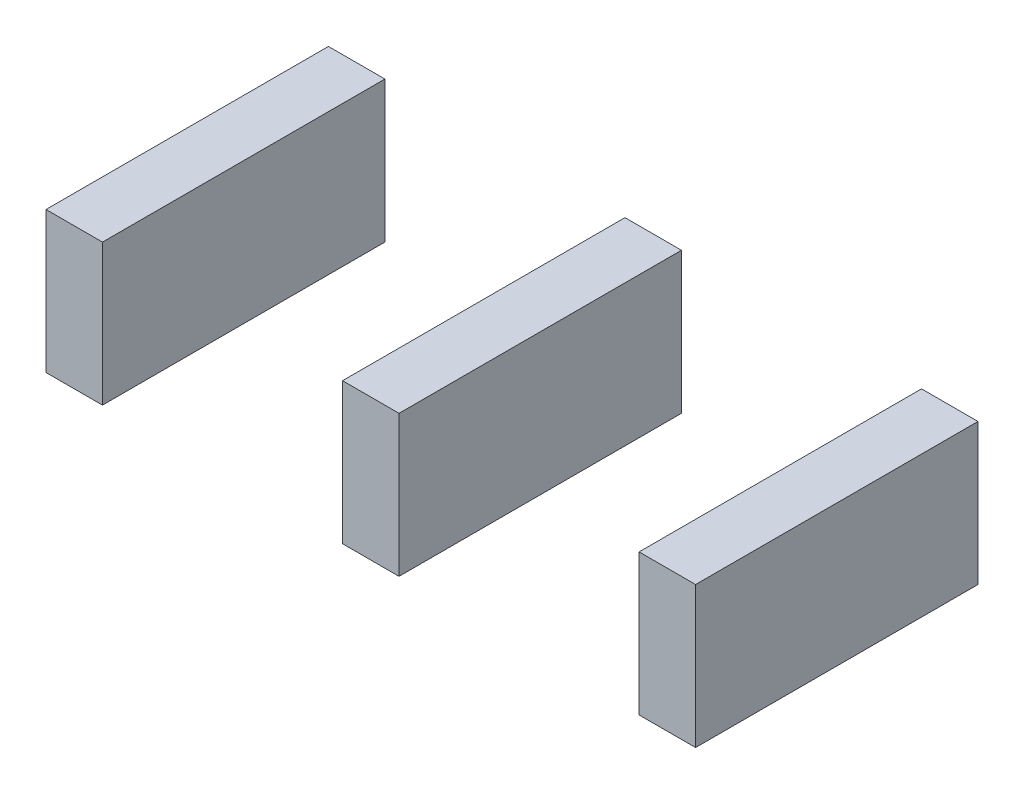
from build123d import *

# Parameters (mm, degrees)
SKETCH1_W             = 0.8
SKETCH1_H             = 2
BOSS_EXTRUDE1_DEPTH   = 4
BOSS_EXTRUDE1_2_DEPTH = 4
BOSS_EXTRUDE1_3_DEPTH = 4


with BuildPart() as part:
    # Sketch1 → Boss-Extrude1 (new body)
    with BuildSketch(Plane.XY):
        with Locations((4.2, 0)):
            Rectangle(SKETCH1_W, SKETCH1_H)
    extrude(amount=BOSS_EXTRUDE1_DEPTH)


with BuildPart() as body_2:
    # Sketch1 → Boss-Extrude1 2 (new body)
    with BuildSketch(Plane.XY):
        Rectangle(SKETCH1_W, SKETCH1_H)
    extrude(amount=BOSS_EXTRUDE1_2_DEPTH)


with BuildPart() as body_3:
    # Sketch1 → Boss-Extrude1 3 (new body)
    with BuildSketch(Plane.XY):
        with Locations((-4.2, 0)):
            Rectangle(SKETCH1_W, SKETCH1_H)
    extrude(amount=BOSS_EXTRUDE1_3_DEPTH)


solid = Compound([part.part, body_2.part, body_3.part])
